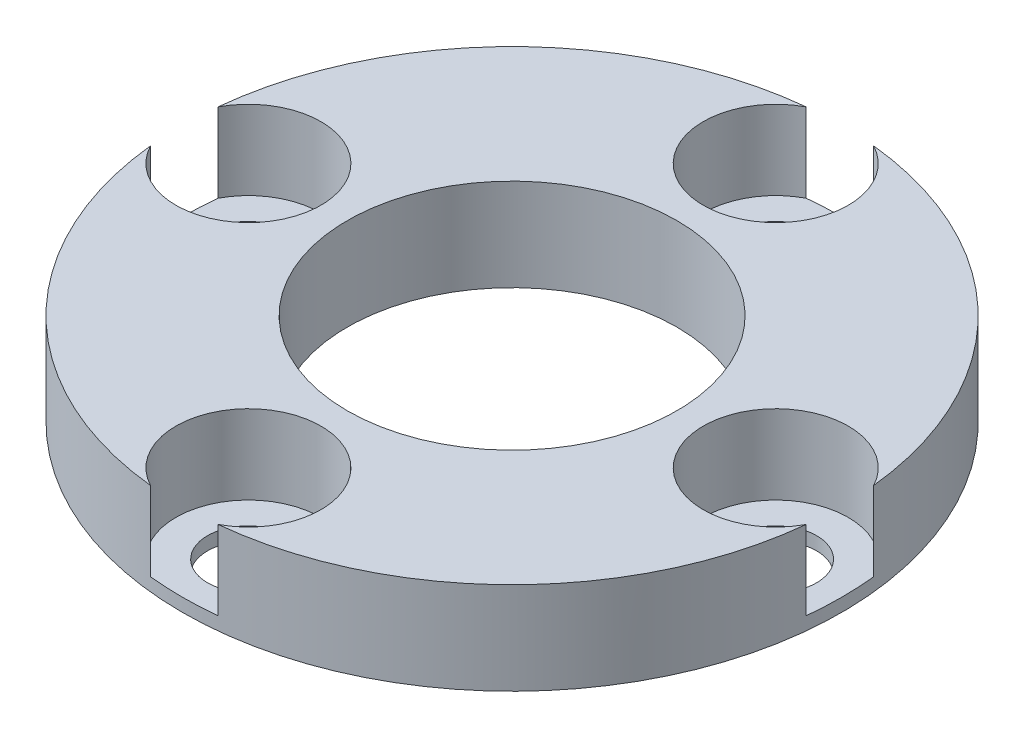
from build123d import *

# Parameters (mm, degrees)
SKETCH_1_R          = 12.5
SKETCH_1_R_2        = 6.25
EXTRUDE_1_DEPTH     = 3.5
SKETCH_2_R          = 1.55
CUT_EXTRUDE_1_DEPTH = 10
SKETCH_3_R          = 2.75
CUT_EXTRUDE_2_DEPTH = 3


with BuildPart() as part:
    # 草图1 → 凸台-拉伸1 (new body)
    with BuildSketch(Plane(origin=(0, 0, 0), x_dir=(1, 0, 0), z_dir=(0, 1, 0))):
        with Locations(Location((0, 0, 0), (0, 0, 270))):
            Circle(SKETCH_1_R)
        with Locations(Location((0, 0, 0), (0, 0, 270))):
            Circle(SKETCH_1_R_2, mode=Mode.SUBTRACT)
    extrude(amount=EXTRUDE_1_DEPTH)

    # 草图2 → 切除-拉伸1 (cut)
    with BuildSketch(Plane(origin=(0, 3.5, 0), x_dir=(1, 0, 0), z_dir=(0, 1, 0))):
        with Locations(Location((-10, 0, 0), (0, 0, 270))):
            Circle(SKETCH_2_R)
        with Locations(Location((0, 10, 0), (0, 0, 270))):
            Circle(SKETCH_2_R)
        with Locations(Location((10, 0, 0), (0, 0, 270))):
            Circle(SKETCH_2_R)
        with Locations(Location((0, -10, 0), (0, 0, 270))):
            Circle(SKETCH_2_R)
    extrude(amount=-CUT_EXTRUDE_1_DEPTH, mode=Mode.SUBTRACT)

    # 草图3 → 切除-拉伸2 (cut)
    with BuildSketch(Plane(origin=(0, 3.5, 0), x_dir=(1, 0, 0), z_dir=(0, 1, 0))):
        with Locations((-10, 0)):
            Circle(SKETCH_3_R)
        with Locations((0, 10)):
            Circle(SKETCH_3_R)
        with Locations((10, 0)):
            Circle(SKETCH_3_R)
        with Locations((0, -10)):
            Circle(SKETCH_3_R)
    extrude(amount=-CUT_EXTRUDE_2_DEPTH, mode=Mode.SUBTRACT)


solid = part.part
